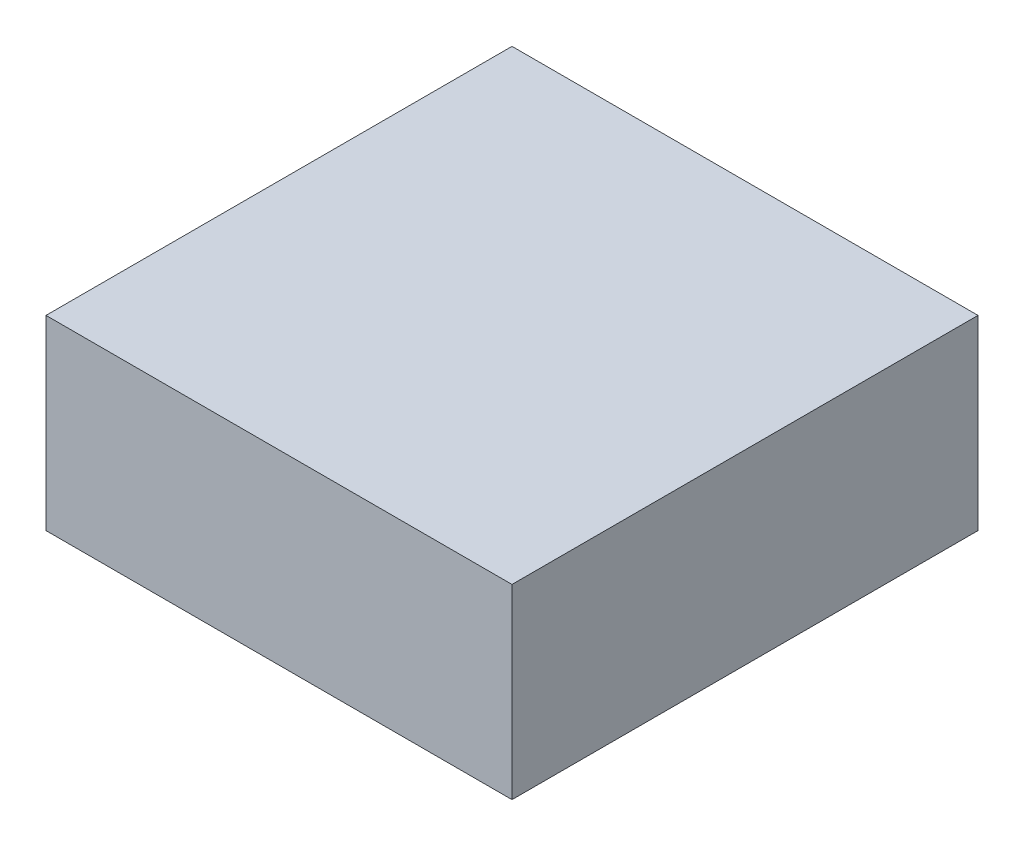
from build123d import *

# Parameters (mm, degrees)
SKETCH_1_W      = 125
SKETCH_1_H      = 125
EXTRUDE_1_DEPTH = 50


with BuildPart() as part:
    # 草图1 → 凸台-拉伸1 (new body)
    with BuildSketch(Plane(origin=(0, 0, 0), x_dir=(1, 0, 0), z_dir=(0, 1, 0))):
        Rectangle(SKETCH_1_W, SKETCH_1_H)
    extrude(amount=EXTRUDE_1_DEPTH)


solid = part.part
